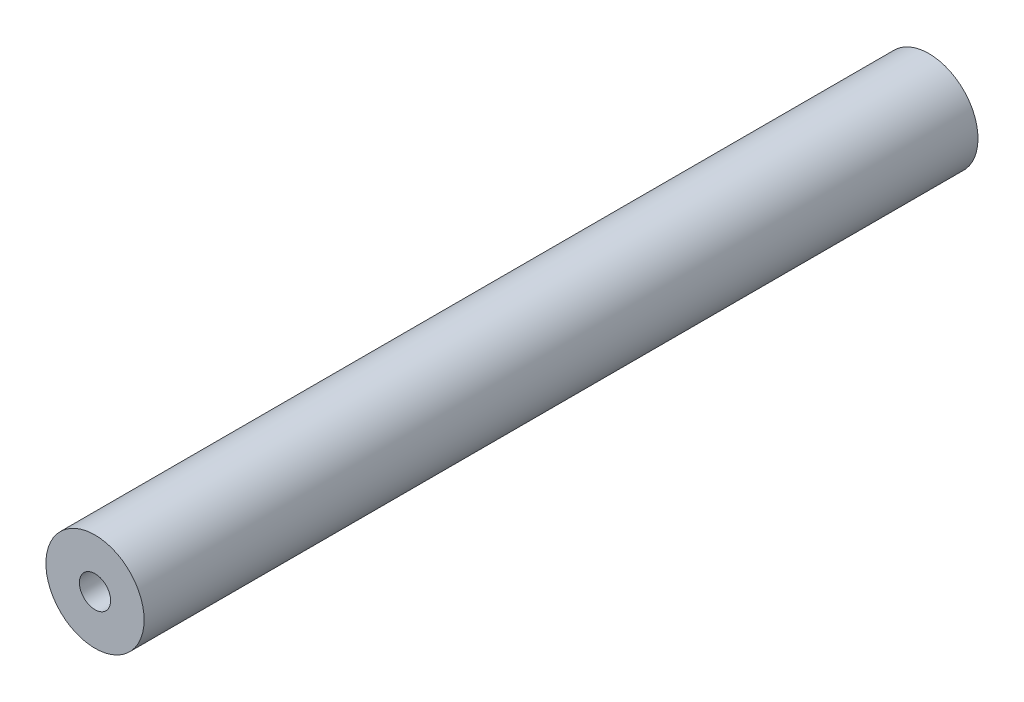
from build123d import *

# Parameters (mm, degrees)
SKETCH1_R                  = 6.35
BOSS_EXTRUDE1_DEPTH        = 107.8484
F_10_32_TAPPED_HOLE2_D     = 4.0386
F_10_32_TAPPED_HOLE2_DEPTH = 9.906
F_10_32_TAPPED_HOLE2_TIP   = 1.213317848
F_10_32_TAPPED_HOLE1_D     = 4.0386
F_10_32_TAPPED_HOLE1_DEPTH = 11.938
F_10_32_TAPPED_HOLE1_TIP   = 1.213317848


with BuildPart() as part:
    # Sketch1 → Boss-Extrude1 (new body)
    with BuildSketch(Plane.XY):
        Circle(SKETCH1_R)
    extrude(amount=BOSS_EXTRUDE1_DEPTH)

    # #10-32 Tapped Hole2
    with Locations(Plane.XY.offset(107.8484)):
        with Locations((0, 0)):
            Hole(F_10_32_TAPPED_HOLE2_D / 2, depth=F_10_32_TAPPED_HOLE2_DEPTH)
            with Locations((0, 0, -(F_10_32_TAPPED_HOLE2_DEPTH + F_10_32_TAPPED_HOLE2_TIP / 2))):  # 118° drill point
                Cone(0, F_10_32_TAPPED_HOLE2_D / 2, F_10_32_TAPPED_HOLE2_TIP, mode=Mode.SUBTRACT)

    # #10-32 Tapped Hole1
    with Locations(Plane(origin=(0, 0, 0), x_dir=(-1, 0, 0), z_dir=(0, 0, -1))):
        with Locations((0, 0)):
            Hole(F_10_32_TAPPED_HOLE1_D / 2, depth=F_10_32_TAPPED_HOLE1_DEPTH)
            with Locations((0, 0, -(F_10_32_TAPPED_HOLE1_DEPTH + F_10_32_TAPPED_HOLE1_TIP / 2))):  # 118° drill point
                Cone(0, F_10_32_TAPPED_HOLE1_D / 2, F_10_32_TAPPED_HOLE1_TIP, mode=Mode.SUBTRACT)


solid = part.part
